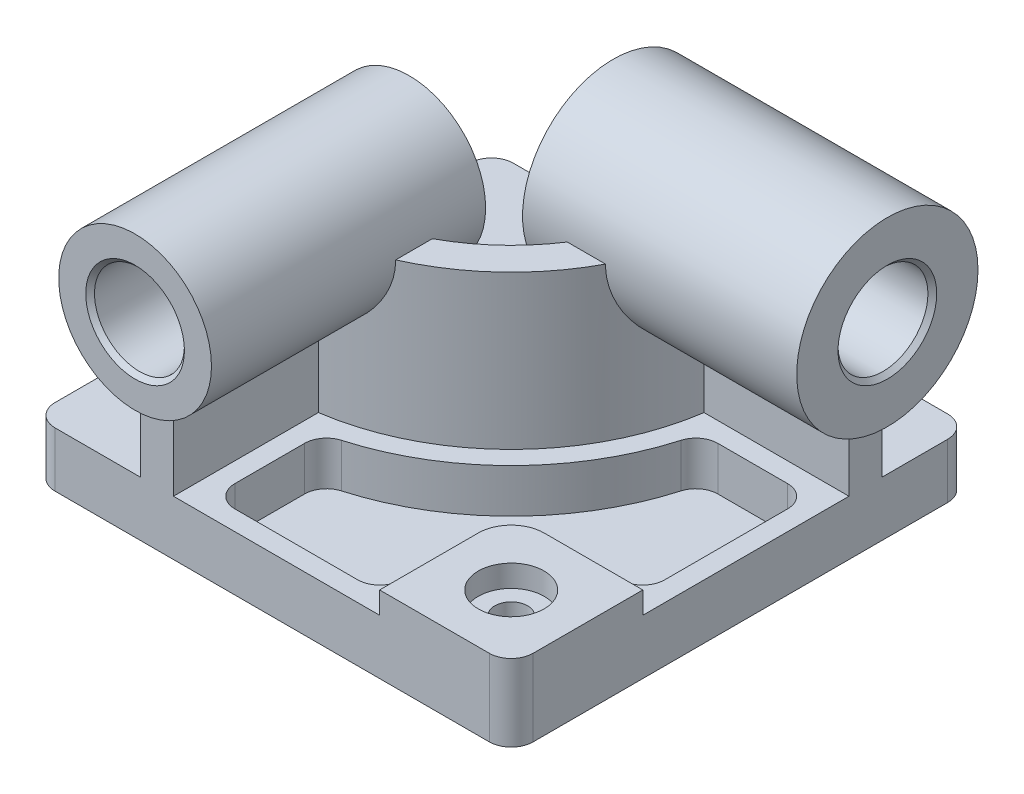
from build123d import *

# Parameters (mm, degrees)
BOSS_EXTRUDE1_DEPTH                     = 25
BOSS_EXTRUDE2_START                     = -25
BOSS_EXTRUDE2_DEPTH                     = 95
BOSS_EXTRUDE3_DEPTH                     = 10
CBORE_FOR_M8_HEX_HEAD_BOLT1_D           = 15
CBORE_FOR_M8_HEX_HEAD_BOLT1_CBORE_D     = 30
CBORE_FOR_M8_HEX_HEAD_BOLT1_CBORE_DEPTH = 10
CUT_EXTRUDE1_DEPTH                      = 20
BOSS_EXTRUDE4_START                     = 10
SKETCH7_R                               = 34.833333333
BOSS_EXTRUDE4_DEPTH                     = 125
BOSS_EXTRUDE5_START                     = 10
SKETCH8_R                               = 41.333333333
BOSS_EXTRUDE5_DEPTH                     = 125
CUT_EXTRUDE2_REACH                      = 315.988
SKETCH9_R                               = 20.5
CUT_EXTRUDE3_REACH                      = 322.331
SKETCH10_R                              = 20.5
CHAMFER1_SIZE                           = 2


with BuildPart() as part:
    # Sketch1 → Boss-Extrude1 (new body)
    with BuildSketch(Plane(origin=(0, 0, 0), x_dir=(1, 0, 0), z_dir=(0, 1, 0))):
        with BuildLine():
            Line((-39, 40), (159, 40))
            ThreePointArc((159, 40), (166.071067812, 37.071067812), (169, 30))
            Line((169, 30), (169, -159))
            ThreePointArc((169, -159), (166.071067812, -166.071067812), (159, -169))
            Line((159, -169), (-39, -169))
            ThreePointArc((-39, -169), (-46.071067812, -166.071067812), (-49, -159))
            Line((-49, -159), (-49, 30))
            ThreePointArc((-49, 30), (-46.071067812, 37.071067812), (-39, 40))
        make_face()
    extrude(amount=BOSS_EXTRUDE1_DEPTH)

    # Sketch2 → Boss-Extrude2 (add)
    with BuildSketch(Plane(origin=(0, 25, 0), x_dir=(1, 0, 0), z_dir=(0, 1, 0)).offset(BOSS_EXTRUDE2_START)):
        with BuildLine():
            Line((0, -89), (0, -169))
            Line((0, -169), (15, -169))
            Line((15, -169), (15, -102.912584265))
            ThreePointArc((15, -102.912584265), (73.539105243, -73.539105243), (102.912584265, -15))
            Line((102.912584265, -15), (169, -15))
            Line((169, -15), (169, 0))
            Line((169, 0), (89, 0))
            ThreePointArc((89, 0), (62.932503526, -62.932503526), (0, -89))
        make_face()
    extrude(amount=BOSS_EXTRUDE2_DEPTH)

    # Sketch3 → Boss-Extrude3 (add)
    with BuildSketch(Plane(origin=(0, 25, 0), x_dir=(1, 0, 0), z_dir=(0, 1, 0))):
        with BuildLine():
            Line((124, -109), (169, -109))
            Line((169, -109), (169, -159))
            ThreePointArc((169, -159), (166.071067812, -166.071067812), (159, -169))
            Line((159, -169), (109, -169))
            Line((109, -169), (109, -124))
            ThreePointArc((109, -124), (113.393398282, -113.393398282), (124, -109))
        make_face()
    extrude(amount=BOSS_EXTRUDE3_DEPTH)

    # CBORE for M8 Hex Head Bolt1 (through all)
    with Locations(Plane(origin=(0, 35, 0), x_dir=(1, 0, 0), z_dir=(0, 1, 0))):
        with Locations((139, -139)):
            CounterBoreHole(CBORE_FOR_M8_HEX_HEAD_BOLT1_D / 2, CBORE_FOR_M8_HEX_HEAD_BOLT1_CBORE_D / 2, CBORE_FOR_M8_HEX_HEAD_BOLT1_CBORE_DEPTH)

    # Sketch6 → Cut-Extrude1 (cut)
    with BuildSketch(Plane(origin=(0, 25, 0), x_dir=(1, 0, 0), z_dir=(0, 1, 0))):
        with BuildLine():
            Line((100, -150), (100, -124))
            ThreePointArc((100, -124), (107.029437252, -107.029437252), (124, -100))
            Line((124, -100), (150, -100))
            ThreePointArc((150, -100), (157.071067812, -97.071067812), (160, -90))
            Line((160, -90), (160, -34))
            ThreePointArc((160, -34), (157.071067812, -26.928932188), (150, -24))
            Line((150, -24), (118.207444774, -24))
            ThreePointArc((118.207444774, -24), (112.192558093, -26.011186683), (108.59708341, -31.235772358))
            ThreePointArc((108.59708341, -31.235772358), (79.903066274, -79.903066274), (31.235772358, -108.59708341))
            ThreePointArc((31.235772358, -108.59708341), (26.011186683, -112.192558093), (24, -118.207444774))
            Line((24, -118.207444774), (24, -150))
            ThreePointArc((24, -150), (26.928932188, -157.071067812), (34, -160))
            Line((34, -160), (90, -160))
            ThreePointArc((90, -160), (97.071067812, -157.071067812), (100, -150))
        make_face()
    extrude(amount=-CUT_EXTRUDE1_DEPTH, mode=Mode.SUBTRACT)

    # Sketch7 → Boss-Extrude4 (add)
    with BuildSketch(Plane.XY.offset(169).offset(BOSS_EXTRUDE4_START)):
        with Locations((7.5, 95)):
            Circle(SKETCH7_R)
    extrude(amount=-BOSS_EXTRUDE4_DEPTH)

    # Sketch8 → Boss-Extrude5 (add)
    with BuildSketch(Plane(origin=(169, 0, 0), x_dir=(0, 0, -1), z_dir=(1, 0, 0)).offset(BOSS_EXTRUDE5_START)):
        with Locations((-7.5, 95)):
            Circle(SKETCH8_R)
    extrude(amount=-BOSS_EXTRUDE5_DEPTH)

    # Sketch9 → Cut-Extrude2 (cut, up to next)
    with BuildSketch(Plane.XY.offset(179), mode=Mode.PRIVATE) as cut_extrude2_sk1:
        with Locations((7.5, 95)):
            Circle(SKETCH9_R)
    cut_extrude2_tool1 = extrude(cut_extrude2_sk1.sketch, amount=-CUT_EXTRUDE2_REACH, mode=Mode.PRIVATE) & part.part
    add(cut_extrude2_tool1.solids().sort_by_distance((7.5, 95, 179))[0], mode=Mode.SUBTRACT)

    # Sketch10 → Cut-Extrude3 (cut, up to next)
    with BuildSketch(Plane(origin=(179, 0, 0), x_dir=(0, 0, -1), z_dir=(1, 0, 0)), mode=Mode.PRIVATE) as cut_extrude3_sk1:
        with Locations((-7.5, 95)):
            Circle(SKETCH10_R)
    cut_extrude3_tool1 = extrude(cut_extrude3_sk1.sketch, amount=-CUT_EXTRUDE3_REACH, mode=Mode.PRIVATE) & part.part
    add(cut_extrude3_tool1.solids().sort_by_distance((179, 95, 7.5))[0], mode=Mode.SUBTRACT)

    # Chamfer1
    chamfer1_edges = [part.edges().sort_by_distance(p)[0] for p in [
        (-13, 95, 179),
        (-13, 95, 54),
        (179, 95, 28),
        (54, 95, 28),
    ]]
    chamfer(chamfer1_edges, length=CHAMFER1_SIZE)


solid = part.part
